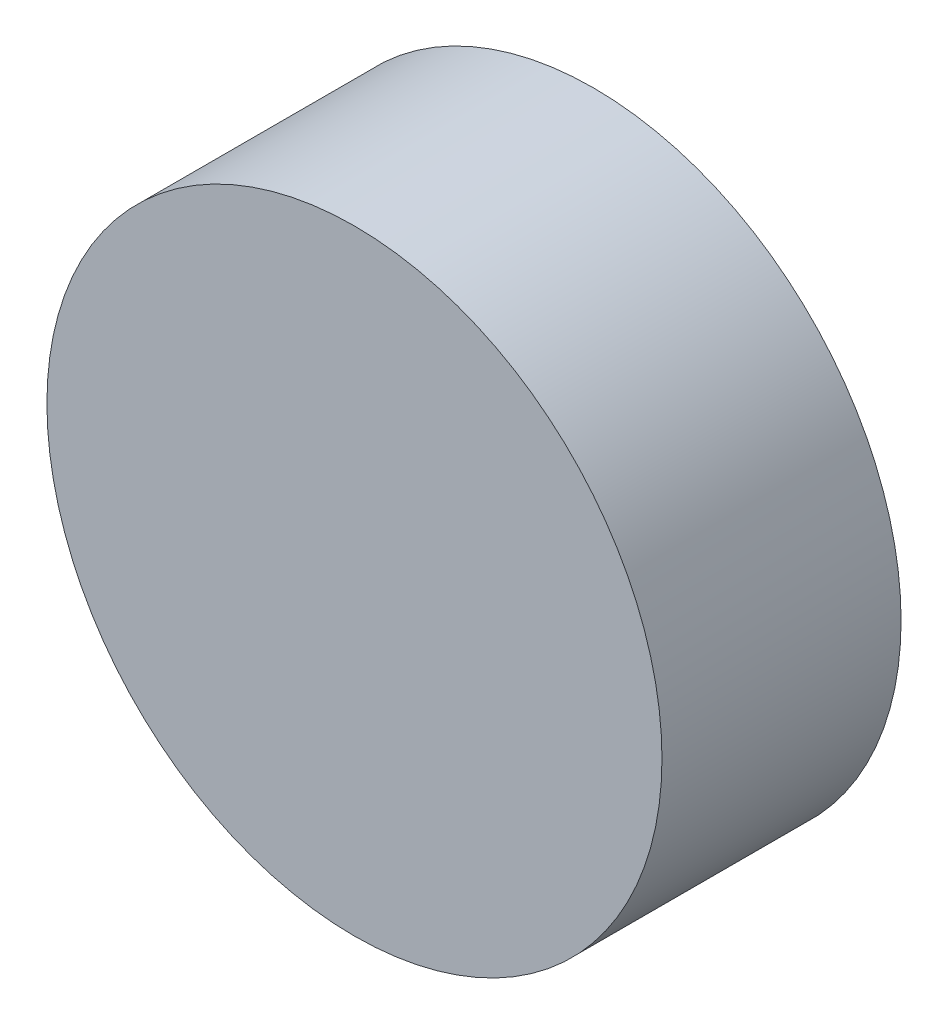
from build123d import *

# Parameters (mm, degrees)
SKETCH1_R           = 12.861967487
BOSS_EXTRUDE1_DEPTH = 10


with BuildPart() as part:
    # Sketch1 → Boss-Extrude1 (new body)
    with BuildSketch(Plane.XY):
        with Locations((51.99331676, -18.05332797)):
            Circle(SKETCH1_R)
    extrude(amount=BOSS_EXTRUDE1_DEPTH)


solid = part.part
